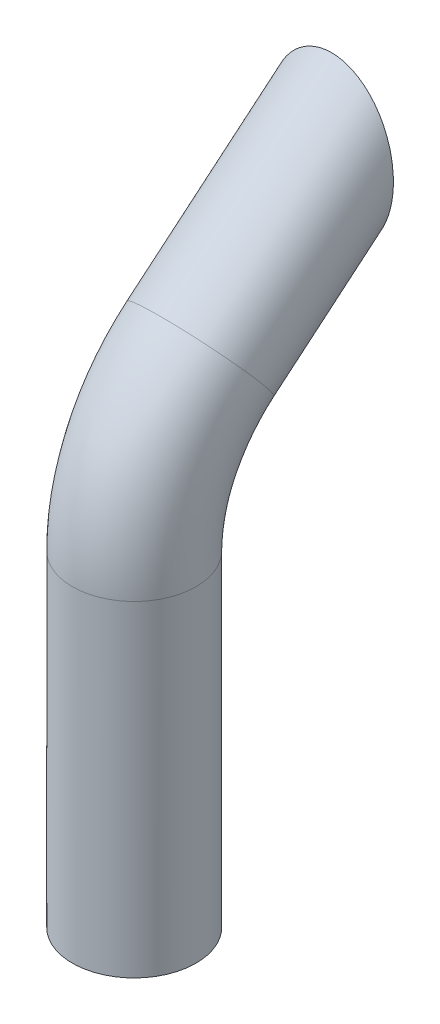
from build123d import *

# Parameters (mm, degrees)
SKETCH2_R          = 30
SKETCH2_R_2        = 27
SKETCH3_W          = 91.659514172
SKETCH3_H          = 84.877806589
CUT_EXTRUDE1_DEPTH = 50


with BuildPart() as part:
    # Sweep-Thin1: sweep along a path in Sketch1
    with BuildLine(Plane(origin=(0, 0, 0), x_dir=(0, 0, -1), z_dir=(1, 0, 0))) as sweep_thin1_path:
        Line((0, 0), (-82.75755134, -69.441830806))
        ThreePointArc((-82.75755134, -69.441830806), (-106.474367301, -100.35018713), (-114.906666468, -138.385830687))
        Line((-114.906666468, -138.385830687), (-114.906666468, -296.418141453))
    # Sketch2 → Sweep-Thin1 (sweep)
    with BuildSketch(Plane(origin=(0, 0, 0), x_dir=(1, 0, 0), z_dir=(0, -0.642787609686538, 0.7660444431189792))):
        Circle(SKETCH2_R)
        Circle(SKETCH2_R_2, mode=Mode.SUBTRACT)
    sweep(path=sweep_thin1_path.line)

    # Sketch3 → Cut-Extrude1 (cut, symmetric)
    with BuildSketch(Plane(origin=(0, 0, 0), x_dir=(0, 0, -1), z_dir=(1, 0, 0))):
        with Locations((26.546128795, -19.457570001)):
            Rectangle(SKETCH3_W, SKETCH3_H)
    extrude(amount=CUT_EXTRUDE1_DEPTH, both=True, mode=Mode.SUBTRACT)


solid = part.part
